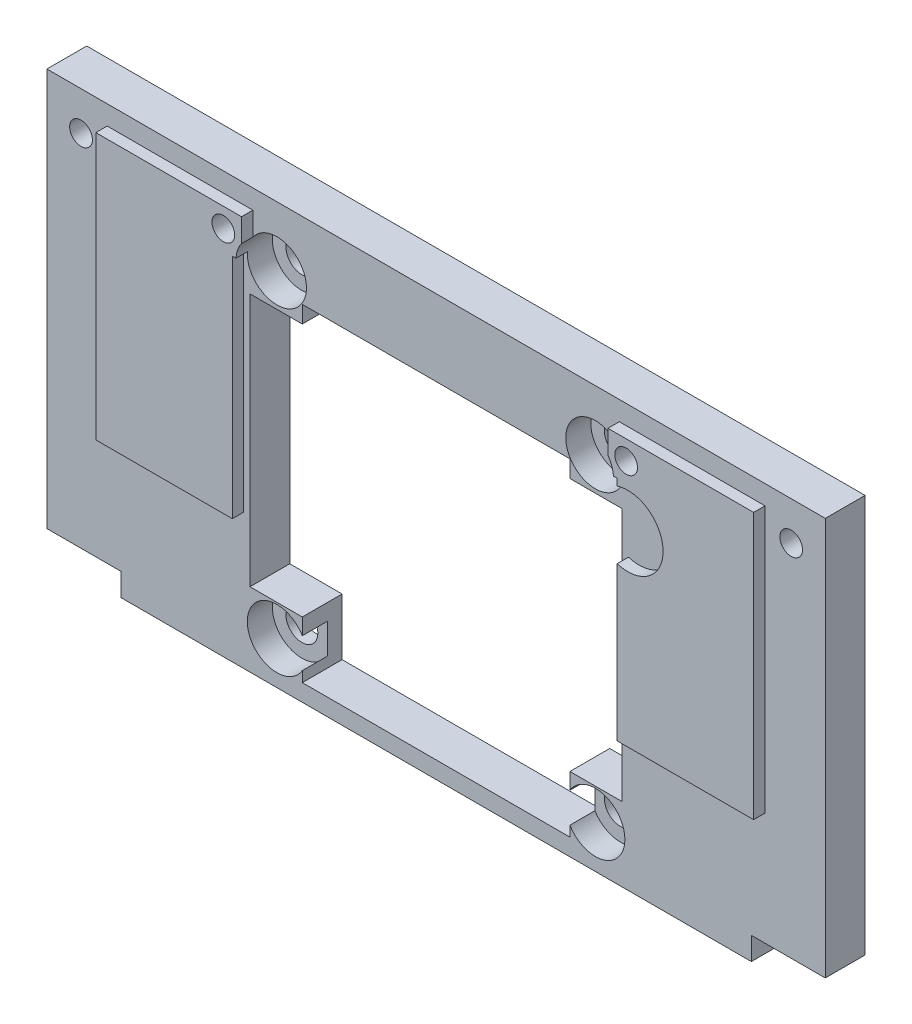
from build123d import *

# Parameters (mm, degrees)
SKETCH3_R           = 1.4
SKETCH3_R_2         = 1
BOSS_EXTRUDE1_DEPTH = 3.5
SKETCH9_R           = 2.6
CUT_EXTRUDE1_DEPTH  = 2.2
SKETCH10_W          = 20
SKETCH10_H          = 2.5
CUT_EXTRUDE2_DEPTH  = 1.75
SKETCH11_R          = 1
BOSS_EXTRUDE2_DEPTH = 1
SKETCH14_R          = 3.1
CUT_EXTRUDE3_DEPTH  = 1
SKETCH15_W          = 6.5
SKETCH15_H          = 2
CUT_EXTRUDE4_DEPTH  = 53.08126138


with BuildPart() as part:
    # Sketch3 → Boss-Extrude1 (new body)
    with BuildSketch(Plane.XY):
        Polygon((-37.436821352, -0.962627815), (-37.436821352, 36.037372185), (31.003178648, 36.037372185), (31.003178648, -0.962627815), (7.298178648, -0.962627815), (-14.831821352, -0.962627815), align=None)
        with Locations((-17.216821352, 30.777902568)):
            Circle(SKETCH3_R, mode=Mode.SUBTRACT)
        with Locations((-34.436821352, 32.642902568)):
            Circle(SKETCH3_R_2, mode=Mode.SUBTRACT)
        with Locations((-20.926821352, 32.642902568)):
            Circle(SKETCH3_R_2, mode=Mode.SUBTRACT)
        with Locations((14.493178648, 32.642902568)):
            Circle(SKETCH3_R_2, mode=Mode.SUBTRACT)
        with Locations((28.003178648, 32.642902568)):
            Circle(SKETCH3_R_2, mode=Mode.SUBTRACT)
        with Locations((-17.216821352, 2.777902568)):
            Circle(SKETCH3_R, mode=Mode.SUBTRACT)
        with Locations((10.783178648, 30.777902568)):
            Circle(SKETCH3_R, mode=Mode.SUBTRACT)
        with Locations((10.783178648, 2.777902568)):
            Circle(SKETCH3_R, mode=Mode.SUBTRACT)
        Polygon((-14.981821352, 0.537372185), (-14.981821352, 5.537372185), (-19.581821352, 5.537372185), (-19.581821352, 27.842902568), (-14.981821352, 27.842902568), (-14.981821352, 29.342902568), (8.548178648, 29.342902568), (8.548178648, 27.842902568), (13.148178648, 27.842902568), (13.148178648, 5.537372185), (8.548178648, 5.537372185), (8.548178648, 0.537372185), align=None, mode=Mode.SUBTRACT)
    extrude(amount=BOSS_EXTRUDE1_DEPTH)

    # Sketch9 → Cut-Extrude1 (cut)
    with BuildSketch(Plane(origin=(0, 0, 3.5), x_dir=(-1, 0, 0), z_dir=(0, 0, -1))):
        with Locations((-10.783178648, 30.777902568)):
            Circle(SKETCH9_R)
        with Locations((17.216821352, 30.777902568)):
            Circle(SKETCH9_R)
        with Locations((-10.783178648, 2.777902568)):
            Circle(SKETCH9_R)
        with Locations((17.216821352, 2.777902568)):
            Circle(SKETCH9_R)
    extrude(amount=CUT_EXTRUDE1_DEPTH, mode=Mode.SUBTRACT)

    # Sketch10 → Cut-Extrude2 (cut)
    with BuildSketch(Plane(origin=(0, 0, 0), x_dir=(-1, 0, 0), z_dir=(0, 0, -1))):
        with Locations((3.216821352, 30.592902568)):
            Rectangle(SKETCH10_W, SKETCH10_H)
    extrude(amount=-CUT_EXTRUDE2_DEPTH, mode=Mode.SUBTRACT)

    # Sketch11 → Boss-Extrude2 (add)
    with BuildSketch(Plane.XY.offset(3.5)):
        with BuildLine():
            Line((-32.136821352, 30.942902568), (-32.136821352, 10.942902568))
            Line((-32.136821352, 10.942902568), (-20.136821352, 10.942902568))
            Line((-20.136821352, 10.942902568), (-20.136821352, 30.942902568))
            Line((-20.136821352, 30.942902568), (-19.811580493, 30.942902568))
            ThreePointArc((-19.811580493, 30.942902568), (-19.664705899, 31.654179489), (-19.326821352, 32.297079977))
            Line((-19.326821352, 32.297079977), (-19.326821352, 34.342902568))
            Line((-19.326821352, 34.342902568), (-32.136821352, 34.342902568))
            Line((-32.136821352, 34.342902568), (-32.136821352, 30.942902568))
        make_face()
        with Locations((-20.926821352, 32.642902568)):
            Circle(SKETCH11_R, mode=Mode.SUBTRACT)
    boss_extrude2 = extrude(amount=BOSS_EXTRUDE2_DEPTH)

    # Mirror1: Boss-Extrude2 across plane
    add(boss_extrude2.mirror(Plane.ZY.offset(3.216821352)))

    # Sketch14 → Cut-Extrude3 (cut)
    with BuildSketch(Plane.XY.offset(4.5)):
        with Locations((14.642214959, 27.392343087)):
            Circle(SKETCH14_R)
    extrude(amount=-CUT_EXTRUDE3_DEPTH, mode=Mode.SUBTRACT)

    # Sketch15 → Cut-Extrude4 (cut, through all)
    with BuildSketch(Plane.XY.offset(3.5)):
        with Locations((-34.186821352, 0.037372185)):
            Rectangle(SKETCH15_W, SKETCH15_H)
        with Locations((27.753178648, 0.037372185)):
            Rectangle(SKETCH15_W, SKETCH15_H)
    extrude(amount=-CUT_EXTRUDE4_DEPTH, mode=Mode.SUBTRACT)


solid = part.part
